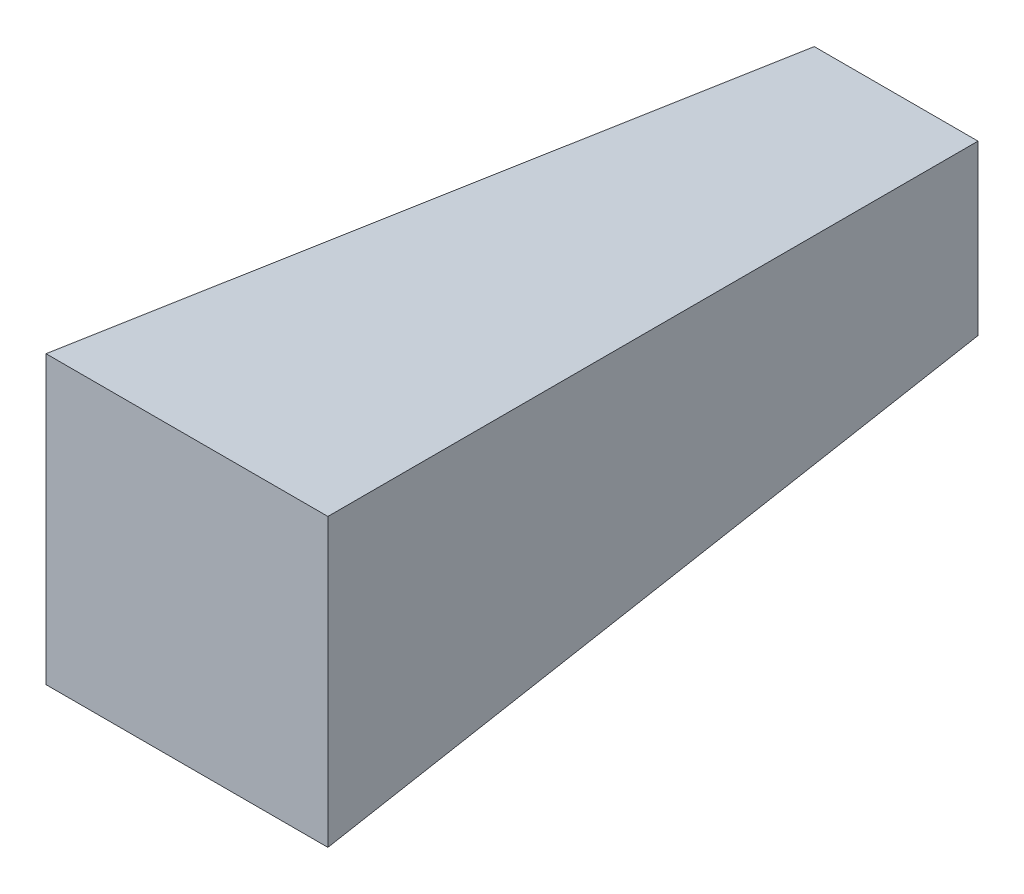
from build123d import *


with BuildPart() as part:
    # Sketch2 → Loft1 section 0
    with BuildSketch(Plane.XY.offset(600)):
        with BuildLine():
            Line((-50, 192.477931937), (-50, -50))
            Line((-50, -50), (188.49, -50))
            Line((188.49, -50), (188.49, 192.477931937))
            Line((188.49, 192.477931937), (-50, 192.477931937))
        make_face()
    # Sketch1 → Loft1 section 1
    with BuildSketch(Plane.XY):
        with BuildLine():
            Line((0, 0), (138.49, 0))
            Line((138.49, 0), (138.49, 142.477931937))
            Line((138.49, 142.477931937), (0, 142.477931937))
            Line((0, 142.477931937), (0, 0))
        make_face()
    loft()


solid = part.part
